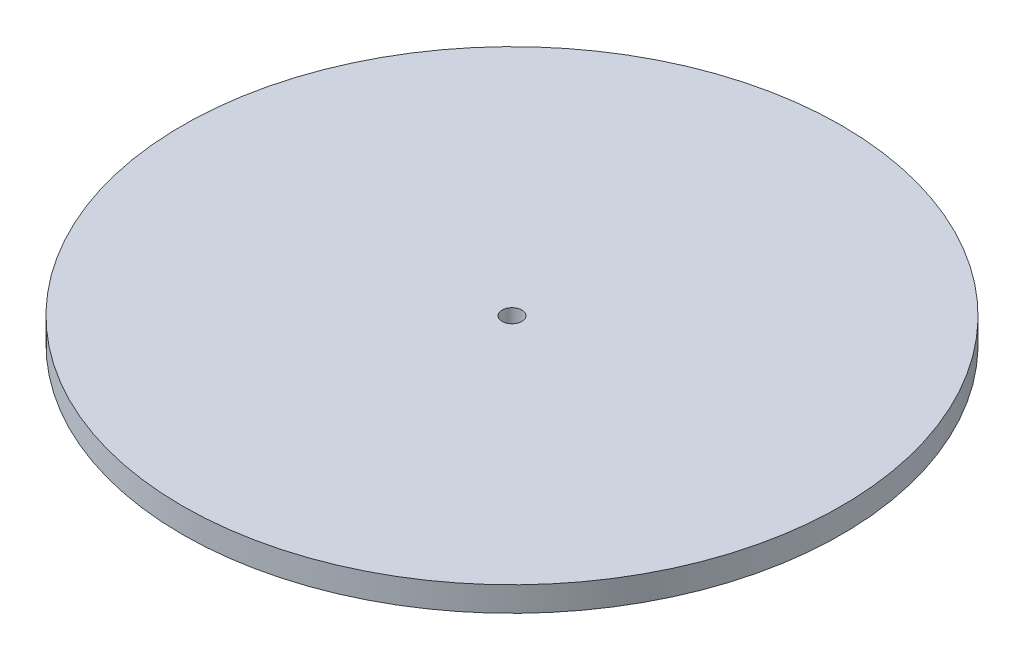
from build123d import *

# Parameters (mm, degrees)
SKETCH5_R          = 1.2
CUT_EXTRUDE1_DEPTH = 59.134629447


with BuildPart() as part:
    # Sketch3 → Revolve4 (revolve)
    with BuildSketch(Plane.XY, mode=Mode.PRIVATE) as revolve4_sk:
        with BuildLine():
            Line((1.2, 13.402803373), (1.2, 8.402803373))
            Line((1.2, 8.402803373), (0, 8.402803373))
            Line((0, 8.402803373), (0, 0))
            add(Edge.make_bspline(
                [(0, 0), (4.625000009, 0.001130642), (9.250000014, 0.546194692), (13.875000014, 1.675812016), (18.500000013, 3.042876604), (23.12500001, 4.548478886), (27.750000007, 6.1395449), (32.375000004, 7.763179662), (37, 9.402803373)],
                knots=[0.083504522, 0.083504522, 0.083504522, 0.083504522, 0.083504522, 0.083504522, 0.083504522, 0.083504522, 0.083504522, 0.918549748, 0.918549748, 0.918549748, 0.918549748, 0.918549748, 0.918549748, 0.918549748, 0.918549748, 0.918549748], degree=8))
            Line((37, 9.402803373), (37, 10.402803373))
            Line((37, 10.402803373), (40, 10.402803373))
            Line((40, 10.402803373), (40, 13.402803373))
            Line((40, 13.402803373), (1.2, 13.402803373))
        make_face()
    revolve(revolve4_sk.sketch.rotate(Axis((0, 13.402803373, 0), (0, -1, 0)), 90), axis=Axis((0, 13.402803373, 0), (0, -1, 0)))

    # Sketch5 → Cut-Extrude1 (cut, through all)
    with BuildSketch(Plane(origin=(0, 13.402803373, 0), x_dir=(1, 0, 0), z_dir=(0, 1, 0))):
        with Locations(Location((0, 0, 0), (0, 0, 270))):
            Circle(SKETCH5_R)
    extrude(amount=-CUT_EXTRUDE1_DEPTH, mode=Mode.SUBTRACT)


solid = part.part
